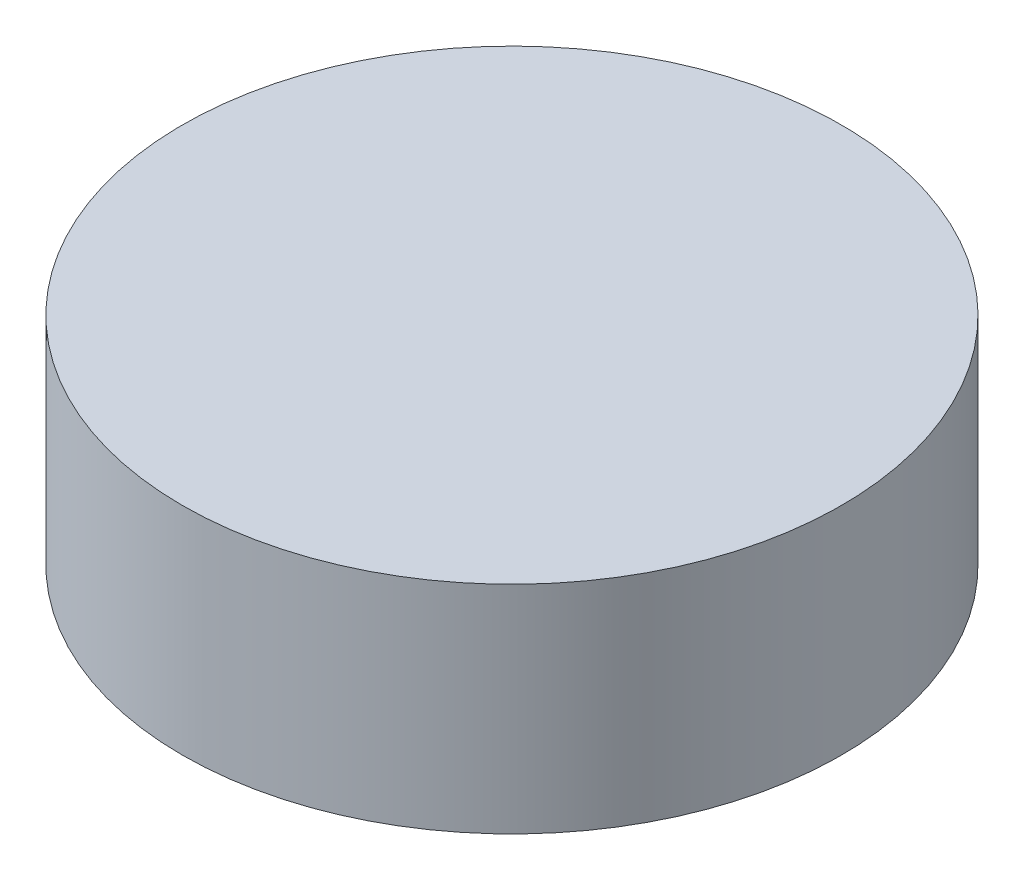
from build123d import *

# Parameters (mm, degrees)
SKETCH1_R           = 76.2
BOSS_EXTRUDE1_DEPTH = 50


with BuildPart() as part:
    # Sketch1 → Boss-Extrude1 (new body)
    with BuildSketch(Plane(origin=(0, 0, 0), x_dir=(1, 0, 0), z_dir=(0, 1, 0))):
        with Locations(Location((0, 0, 0), (0, 0, 270))):
            Circle(SKETCH1_R)
    extrude(amount=BOSS_EXTRUDE1_DEPTH)


solid = part.part
